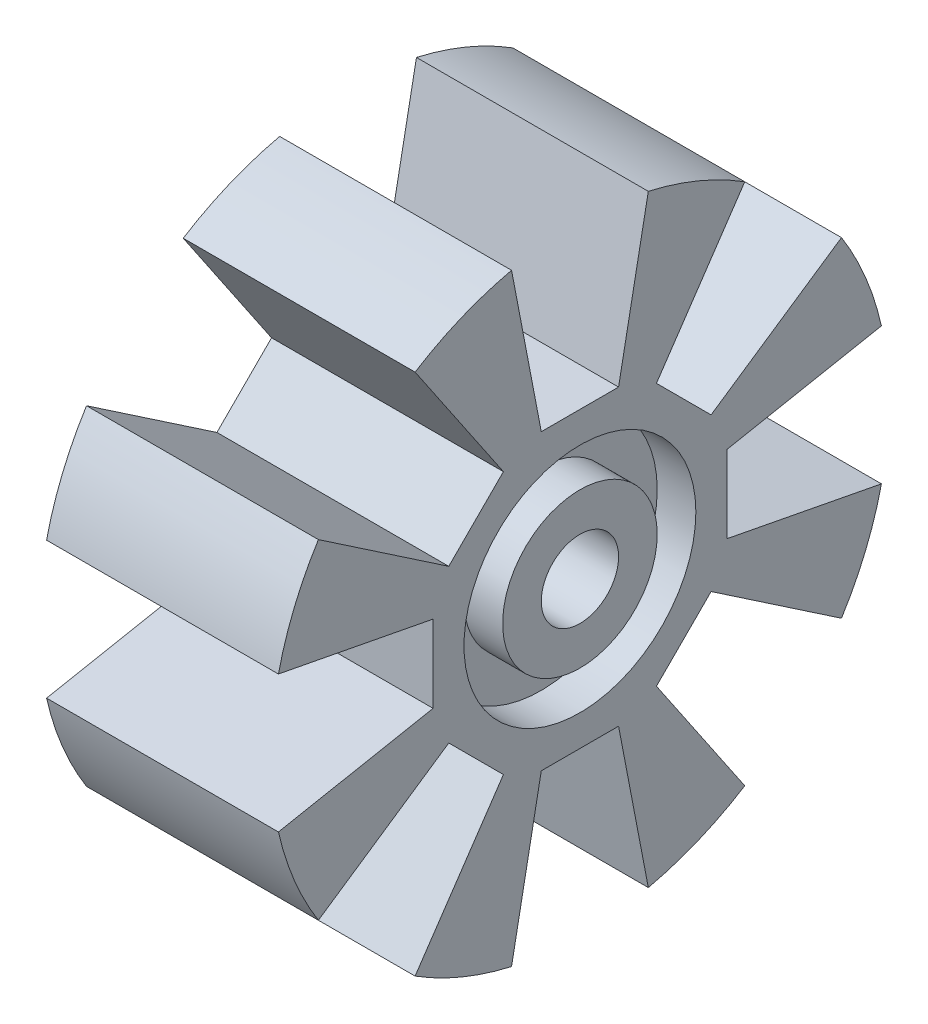
from build123d import *

# Parameters (mm, degrees)
CUT_EXTRUDE6_DEPTH = 65.031242374
CIRPATTERN6_COUNT  = 8


with BuildPart() as part:
    # Sketch2 → Revolve1 (revolve)
    with BuildSketch(Plane.XY, mode=Mode.PRIVATE) as revolve1_sk:
        Polygon((0, 5), (-30, 5), (-30, 10), (-25, 10), (-25, 15), (-30, 15), (-30, 40), (0, 40), (0, 15), (-5, 15), (-5, 10), (0, 10), align=None)
    revolve(revolve1_sk.sketch.rotate(Axis((0, 0, 0), (-1, 0, 0)), 90), axis=Axis((0, 0, 0), (-1, 0, 0)))

    # Sketch8 → Cut-Extrude6 (cut, through all)
    with BuildSketch(Plane.ZY.offset(30)):
        Polygon((-10, 45), (10, 45), (5, 19), (-5, 19), align=None)
    cut_extrude6 = extrude(amount=-CUT_EXTRUDE6_DEPTH, mode=Mode.SUBTRACT)

    # CirPattern6: Cut-Extrude6 ×8 about axis
    cirpattern6_axis = Axis((0, 0, 0), (1, 0, 0))
    for i in range(1, CIRPATTERN6_COUNT):
        add(cut_extrude6.rotate(cirpattern6_axis, i * 360 / CIRPATTERN6_COUNT), mode=Mode.SUBTRACT)


solid = part.part
